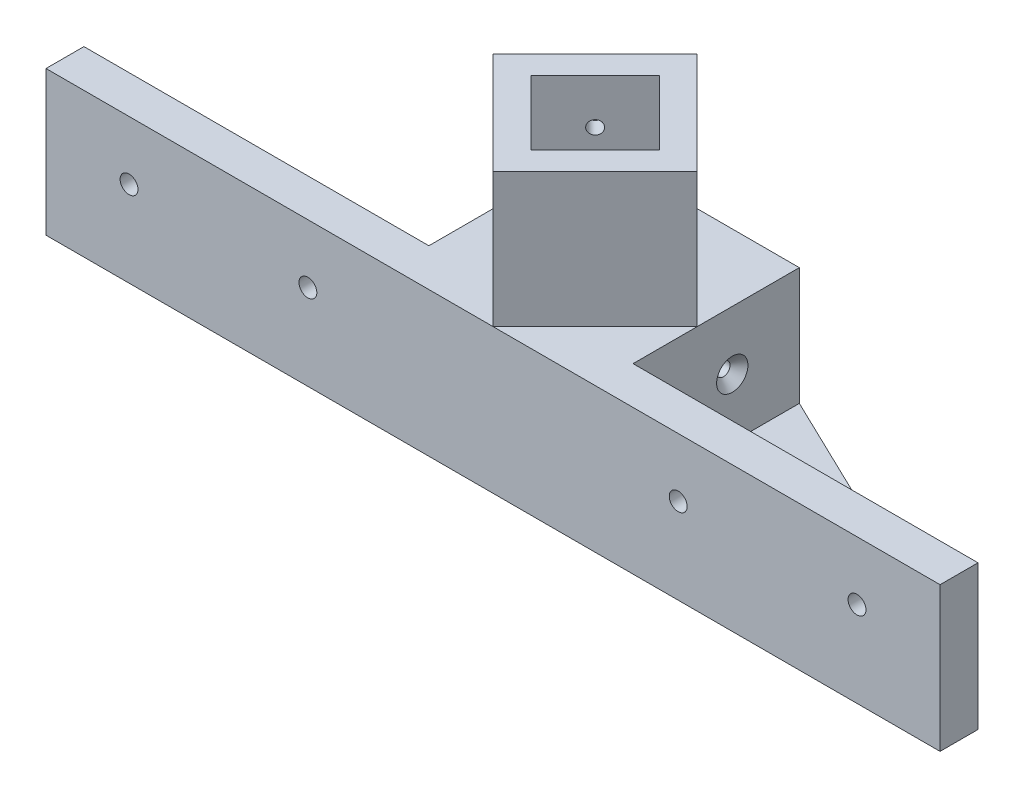
from build123d import *

# Parameters (mm, degrees)
BOSS_EXTRU_1_DEPTH      = 6
BOSS_EXTRU_2_DEPTH      = 20.3
BOSS_EXTRU_3_DEPTH      = 6
BOSS_EXTRU_4_DEPTH      = 30
ESQUISSE5_R             = 1.5
ENL_V_MAT_EXTRU_1_DEPTH = 30
ESQUISSE6_R             = 1.5
ENL_V_MAT_EXTRU_2_DEPTH = 30
ESQUISSE7_R             = 2
ENL_V_MAT_EXTRU_3_DEPTH = 30
CHANFREIN1_SIZE         = 2


with BuildPart() as part:
    # Esquisse1 → Boss.-Extru.1 (new body)
    with BuildSketch(Plane(origin=(0, 0, 0), x_dir=(1, 0, 0), z_dir=(0, 1, 0))):
        Polygon((22.839549032, 45.679098065), (100, 8.485281374), (22.839549032, 8.485281374), align=None)
        Polygon((22.839549032, 45.679098065), (0, 45.679098065), (0, 0), (100, 0), (100, 8.485281374), (22.839549032, 8.485281374), align=None)
    extrude(amount=BOSS_EXTRU_1_DEPTH)

    # Esquisse2 → Boss.-Extru.2 (add)
    with BuildSketch(Plane(origin=(0, 6, 0), x_dir=(1, 0, 0), z_dir=(0, 1, 0))):
        Polygon((22.839549032, 45.679098065), (10.15, 45.679098065), (10.15, 6), (0, 6), (0, 0), (100, 0), (100, 8.485281374), (22.839549032, 8.485281374), align=None)
    extrude(amount=BOSS_EXTRU_2_DEPTH)

    # Esquisse3 → Boss.-Extru.3 (add)
    with BuildSketch(Plane(origin=(0, 26.3, 0), x_dir=(1, 0, 0), z_dir=(0, 1, 0))):
        Polygon((22.839549032, 45.679098065), (0, 45.679098065), (0, 0), (100, 0), (100, 8.485281374), (22.839549032, 8.485281374), align=None)
    extrude(amount=BOSS_EXTRU_3_DEPTH)

    # Esquisse4 → Boss.-Extru.4 (add)
    with BuildSketch(Plane(origin=(0, 32.3, 0), x_dir=(1, 0, 0), z_dir=(0, 1, 0))):
        Polygon((0, 0), (22.839549032, 22.839548119), (0, 45.679098065), (0, 37.193816521), (14.354267489, 22.839548459), (0, 8.485281544), align=None)
    extrude(amount=BOSS_EXTRU_4_DEPTH)

    # Esquisse5 → Enlèv. mat.-Extru.1 (cut)
    with BuildSketch(Plane(origin=(22.839549032, 0, -22.839548119), x_dir=(-0.7071067670543795, 0, -0.7071067953187153), z_dir=(0.7071067953187153, 0, -0.7071067670543795))):
        with Locations((16.150000323, 52.3)):
            Circle(ESQUISSE5_R)
    extrude(amount=-ENL_V_MAT_EXTRU_1_DEPTH, mode=Mode.SUBTRACT)

    # Esquisse6 → Enlèv. mat.-Extru.2 (cut)
    with BuildSketch(Plane(origin=(22.839549032, 0, 0), x_dir=(0, 0, -1), z_dir=(1, 0, 0))):
        with Locations((30.679098065, 19.15)):
            Circle(ESQUISSE6_R)
    extrude(amount=-ENL_V_MAT_EXTRU_2_DEPTH, mode=Mode.SUBTRACT)

    # Esquisse7 → Enlèv. mat.-Extru.3 (cut)
    with BuildSketch(Plane(origin=(0, 0, -8.485281374), x_dir=(-1, 0, 0), z_dir=(0, 0, -1))):
        with Locations((-41.419774516, 19.15)):
            Circle(ESQUISSE7_R)
        with Locations((-81.419774516, 19.15)):
            Circle(ESQUISSE7_R)
    extrude(amount=-ENL_V_MAT_EXTRU_3_DEPTH, mode=Mode.SUBTRACT)

    # Chanfrein1
    chanfrein1_edges = [part.edges().sort_by_distance(p)[0] for p in [
        (12.480434667, 52.3, -33.198662899),
        (22.839549032, 19.15, -29.179098065),
        (43.419774516, 19.15, -8.485281374),
        (83.419774516, 19.15, -8.485281374),
    ]]
    chamfer(chanfrein1_edges, length=CHANFREIN1_SIZE)

    # Symétrie1: part across plane


with BuildPart() as part_1:
    add(part.part)
    add(part.part.mirror(Plane(origin=(0, 6, 0), x_dir=(0, 0, 1), z_dir=(1, 0, 0))))


solid = part_1.part
